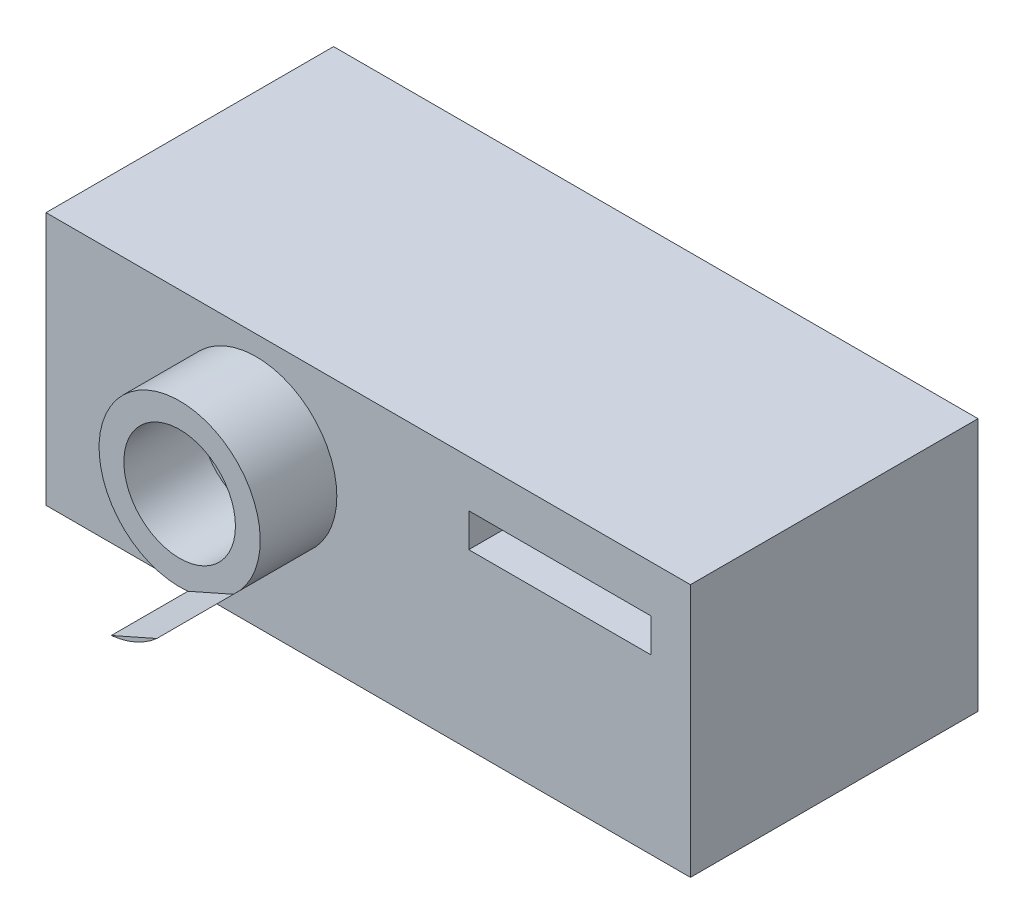
from build123d import *

# Parameters (mm, degrees)
BOSS_EXTRUDE1_DEPTH      = 47.064502155
BOSS_EXTRUDE1_DEPTH_BACK = 1
SKETCH1_W                = 107.713145043
SKETCH1_H                = 42.376311336
SKETCH2_R                = 13.469541987
SKETCH2_R_2              = 9.325857952
BOSS_EXTRUDE2_DEPTH      = 25.604576726
SKETCH3_OUTSIDE_W        = 137.154
SKETCH3_OUTSIDE_H        = 71.816
CUT_EXTRUDE2_DEPTH       = 12.802288363
SKETCH5_W                = 30.426797769
SKETCH5_H                = 5.633317916
CUT_EXTRUDE3_DEPTH       = 19.604576726


with BuildPart() as part:
    # Sketch1 → Boss-Extrude1 (new, two sides: drawn at the far end of the back side and taken through both)
    with BuildSketch(Plane(origin=(-41.279886751, 0, 0), x_dir=(1, 0, 0), z_dir=(0, 0, 1)).offset(-BOSS_EXTRUDE1_DEPTH_BACK)):
        with Locations((16.738942234, -3.835786802)):
            Rectangle(SKETCH1_W, SKETCH1_H)
    extrude(amount=BOSS_EXTRUDE1_DEPTH + BOSS_EXTRUDE1_DEPTH_BACK)

    # Sketch2 → Boss-Extrude2 (add)
    with BuildSketch(Plane(origin=(-44.843209588, 3.141572349, 47.064502155), x_dir=(1, 0, 0), z_dir=(0, 0, 1))):
        with Locations((1.586562206, -2.539630295)):
            Circle(SKETCH2_R)
        with Locations((1.586562206, -2.539630295)):
            Circle(SKETCH2_R_2, mode=Mode.SUBTRACT)
    extrude(amount=BOSS_EXTRUDE2_DEPTH)

    # Sketch3 outside → Cut-Extrude2 (cut, symmetric)
    with BuildSketch(Plane.XY.offset(72.669078881)):
        with Locations((-24.541, -3.836)):
            Rectangle(SKETCH3_OUTSIDE_W, SKETCH3_OUTSIDE_H)
        Polygon((-18.492947879, -30.338784684), (-15.338367542, -1.062929581), (-42.269291948, -12.968910423), align=None, mode=Mode.SUBTRACT)
    extrude(amount=CUT_EXTRUDE2_DEPTH, both=True, mode=Mode.SUBTRACT)

    # Sketch5 → Cut-Extrude3 (cut)
    with BuildSketch(Plane.XY.offset(47.064502155)):
        with Locations((7.480827718, 6.71069858)):
            Rectangle(SKETCH5_W, SKETCH5_H)
    extrude(amount=-CUT_EXTRUDE3_DEPTH, mode=Mode.SUBTRACT)


solid = part.part
